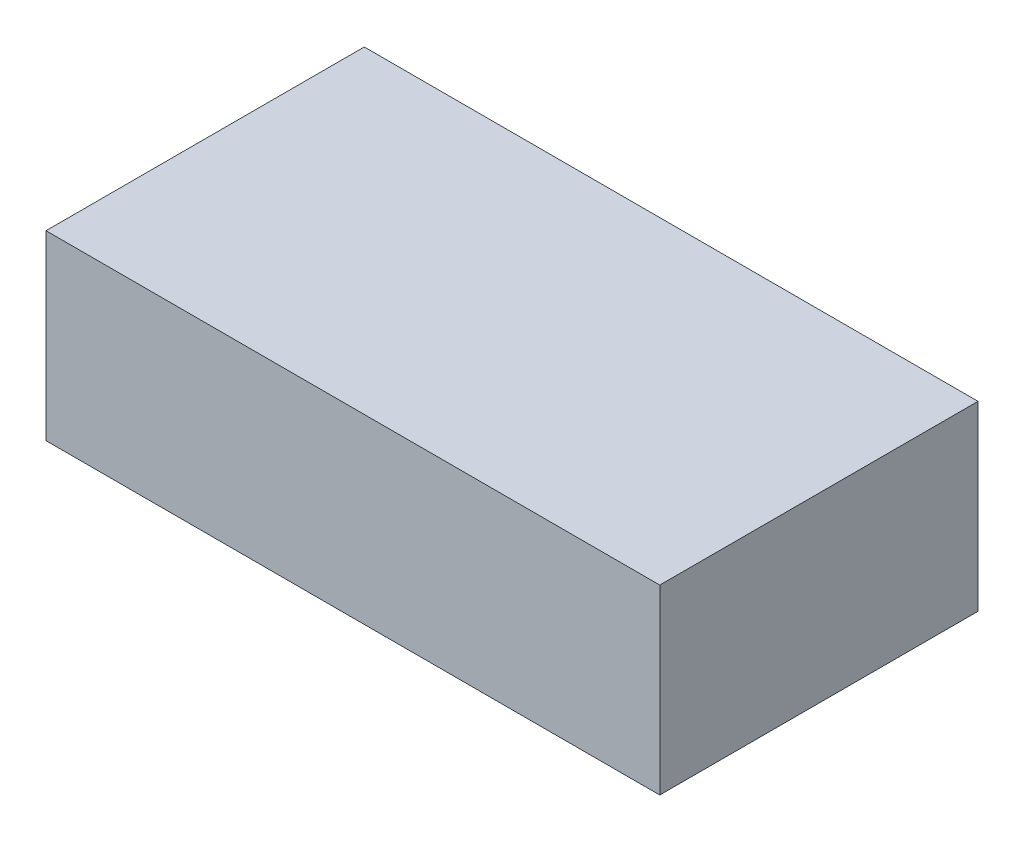
from build123d import *

# Parameters (mm, degrees)
SKETCH1_W     = 27
SKETCH1_H     = 14
HOUSING_DEPTH = 8


with BuildPart() as part:
    # Sketch1 → Housing (new body)
    with BuildSketch(Plane(origin=(0, 0, 0), x_dir=(1, 0, 0), z_dir=(0, 1, 0))):
        Rectangle(SKETCH1_W, SKETCH1_H)
    extrude(amount=HOUSING_DEPTH)


solid = part.part
